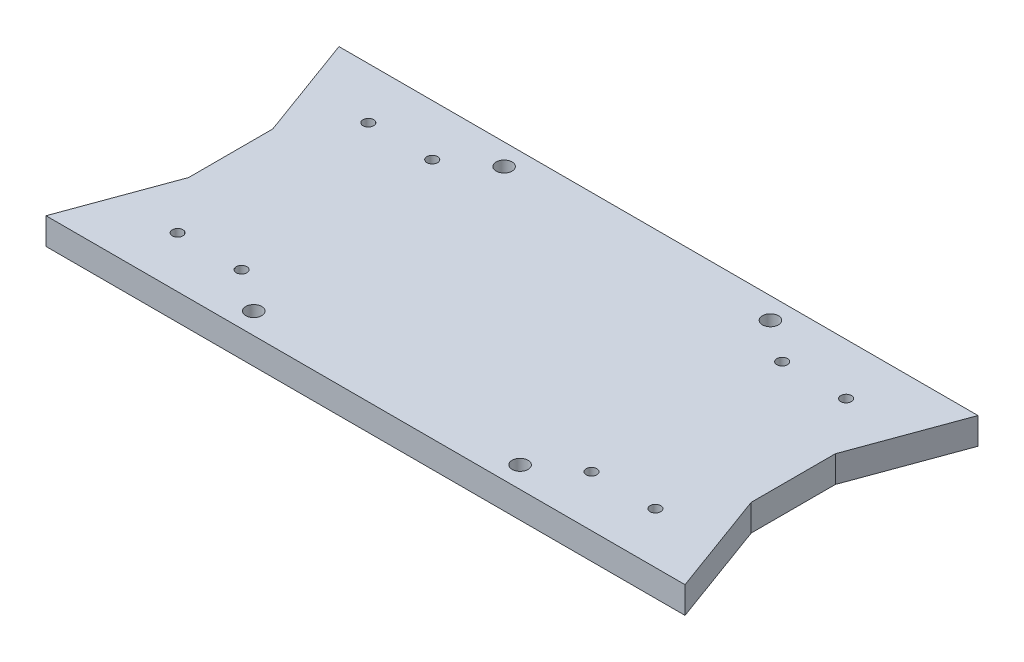
from build123d import *

# Parameters (mm, degrees)
SKETCH1_W           = 67.061286962
SKETCH1_H           = 69.85
SKETCH1_R           = 1.27
BOSS_EXTRUDE1_DEPTH = 6.35
SKETCH2_W           = 20.976278342
SKETCH2_H           = 20.060000012
BOSS_EXTRUDE2_DEPTH = 12.7
BOSS_EXTRUDE3_DEPTH = 6.35
SKETCH4_W           = 170.998259203
SKETCH4_H           = 17.997071231
CUT_EXTRUDE1_DEPTH  = 136.477531157
SKETCH8_R           = 1.905
CUT_EXTRUDE3_DEPTH  = 13.716


with BuildPart() as part:
    # Sketch1 → Boss-Extrude1 (new body)
    with BuildSketch(Plane(origin=(0, 0, 0), x_dir=(1, 0, 0), z_dir=(0, 1, 0))):
        with Locations((-4.803022, 67.707661351)):
            Rectangle(SKETCH1_W, SKETCH1_H)
        with Locations(Location((3.381343157, 90.407661351, 0), (0, 0, 270))):
            Circle(SKETCH1_R, mode=Mode.SUBTRACT)
        with Locations(Location((18.621343157, 90.407661351, 0), (0, 0, 270))):
            Circle(SKETCH1_R, mode=Mode.SUBTRACT)
        with Locations(Location((3.381343157, 44.947661351, 0), (0, 0, 270))):
            Circle(SKETCH1_R, mode=Mode.SUBTRACT)
        with Locations(Location((18.621343157, 44.947661351, 0), (0, 0, 270))):
            Circle(SKETCH1_R, mode=Mode.SUBTRACT)
    boss_extrude1 = extrude(amount=BOSS_EXTRUDE1_DEPTH)

    # Sketch2 → Boss-Extrude2 (add)
    with BuildSketch(Plane(origin=(0, 6.35, 0), x_dir=(1, 0, 0), z_dir=(0, 1, 0))):
        with Locations((18.23948231, 67.707661351)):
            Rectangle(SKETCH2_W, SKETCH2_H)
    boss_extrude2 = extrude(amount=BOSS_EXTRUDE2_DEPTH)

    # Sketch3 → Boss-Extrude3 (add)
    with BuildSketch(Plane(origin=(0, 6.35, 0), x_dir=(1, 0, 0), z_dir=(0, 1, 0))):
        Polygon((37.841343157, 102.632661351), (28.727621481, 77.737661357), (28.727621481, 102.632661351), align=None)
        Polygon((28.727621481, 57.677661345), (37.841343157, 32.782661351), (28.727621481, 32.782661351), align=None)
    boss_extrude3 = extrude(amount=-BOSS_EXTRUDE3_DEPTH)

    # Mirror2: Boss-Extrude1, Boss-Extrude2, Boss-Extrude3 across plane
    add(boss_extrude1.mirror(Plane(origin=(-38.333665481, 6.35, -32.782661351), x_dir=(0, 0, 1), z_dir=(1, 0, 0))))
    add(boss_extrude2.mirror(Plane(origin=(-38.333665481, 6.35, -32.782661351), x_dir=(0, 0, 1), z_dir=(1, 0, 0))))
    add(boss_extrude3.mirror(Plane(origin=(-38.333665481, 6.35, -32.782661351), x_dir=(0, 0, 1), z_dir=(1, 0, 0))))

    # Sketch4 → Cut-Extrude1 (cut, through all)
    with BuildSketch(Plane.XY.offset(-32.782661351)):
        with Locations((-47.657786445, 15.348535616)):
            Rectangle(SKETCH4_W, SKETCH4_H)
    extrude(amount=-CUT_EXTRUDE1_DEPTH, mode=Mode.SUBTRACT)

    # Sketch8 → Cut-Extrude3 (cut)
    with BuildSketch(Plane(origin=(0, 6.35, 0), x_dir=(1, 0, 0), z_dir=(0, 1, 0))):
        with Locations(Location((-6.558674119, 97.552661351, 0), (0, 0, 270))):
            Circle(SKETCH8_R)
        with Locations(Location((-6.558674119, 37.862661351, 0), (0, 0, 270))):
            Circle(SKETCH8_R)
        with Locations((-171.91881552, 187.895953706)):
            Circle(SKETCH8_R)
        with Locations(Location((-70.058674119, 97.552661351, 0), (0, 0, 270))):
            Circle(SKETCH8_R)
        with Locations(Location((-70.058674119, 37.862661351, 0), (0, 0, 270))):
            Circle(SKETCH8_R)
    extrude(amount=-CUT_EXTRUDE3_DEPTH, mode=Mode.SUBTRACT)


solid = part.part
